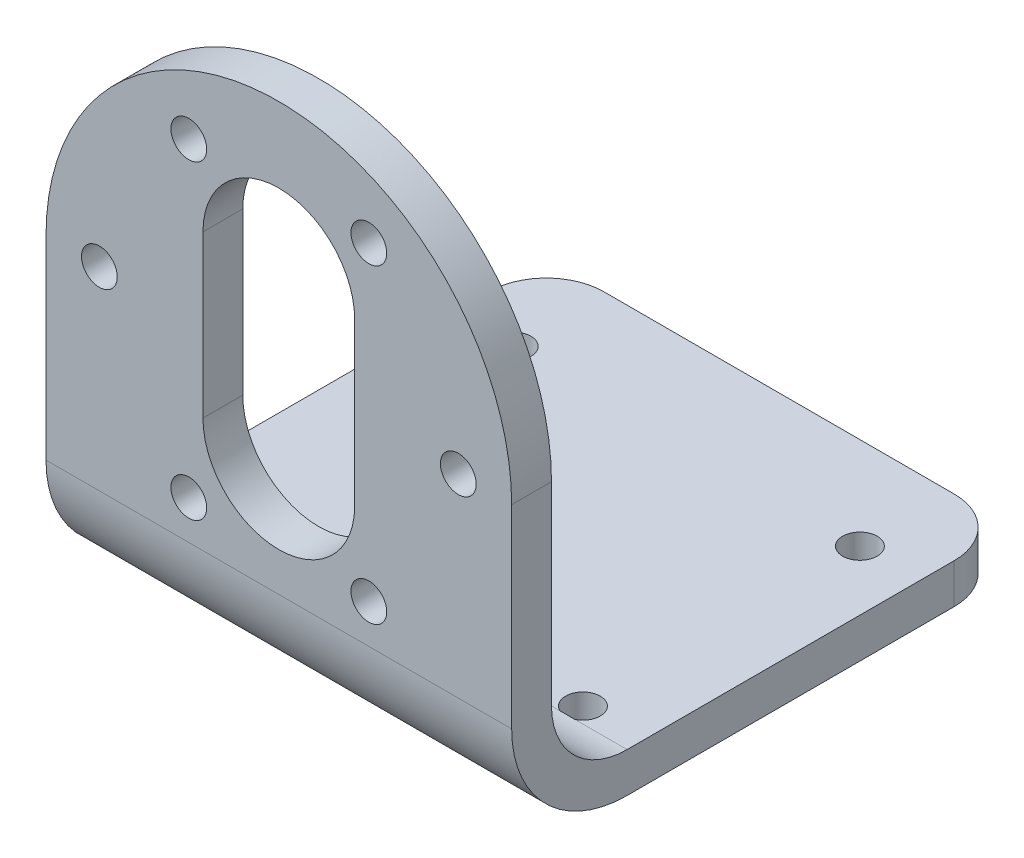
from build123d import *

# Parameters (mm, degrees)
SKETCH1_W           = 40.35
SKETCH1_H           = 43.35
BOSS_EXTRUDE1_DEPTH = 47
CUT_EXTRUDE2_DEPTH  = 102
FILLET1_R           = 10
CUT_EXTRUDE3_DEPTH  = 102
FILLET2_R           = 5
CUT_EXTRUDE5_DEPTH  = 102
SKETCH8_R           = 1.55
CUT_EXTRUDE6_DEPTH  = 102
SKETCH6_R           = 1.5
CUT_EXTRUDE7_DEPTH  = 82.840160626


with BuildPart() as part:
    # Sketch1 → Boss-Extrude1 (new body)
    with BuildSketch(Plane(origin=(0, 0, 0), x_dir=(1, 0, 0), z_dir=(0, 1, 0))):
        with Locations((-26.966212793, -29.108023223)):
            Rectangle(SKETCH1_W, SKETCH1_H)
    extrude(amount=BOSS_EXTRUDE1_DEPTH)

    # Sketch3 → Cut-Extrude2 (cut)
    with BuildSketch(Plane.XY.offset(50.783023223)):
        with BuildLine():
            Line((-47.141212793, 47), (-47.141212793, 26.825))
            ThreePointArc((-47.141212793, 26.825), (-41.232092103, 41.09087931), (-26.966212793, 47))
            Line((-26.966212793, 47), (-47.141212793, 47))
        make_face()
        with BuildLine():
            Line((-6.791212793, 47), (-26.966212793, 47))
            ThreePointArc((-26.966212793, 47), (-12.700333482, 41.09087931), (-6.791212793, 26.825))
            Line((-6.791212793, 26.825), (-6.791212793, 47))
        make_face()
    extrude(amount=-CUT_EXTRUDE2_DEPTH, mode=Mode.SUBTRACT)

    # Fillet1
    fillet1_edges = [part.edges().sort_by_distance(p)[0] for p in [
        (-26.966212793, 0, 50.783023223),
    ]]
    fillet(fillet1_edges, radius=FILLET1_R)

    # Sketch5 → Cut-Extrude3 (cut)
    with BuildSketch(Plane.ZY.offset(47.141212793)):
        with BuildLine():
            Line((-6.665763497, 3.45), (36.595559978, 3.45))
            Line((36.595559978, 3.45), (40.783023223, 3.45))
            ThreePointArc((40.783023223, 3.45), (45.41457264, 5.368450583), (47.333023223, 10))
            Line((47.333023223, 10), (47.333023223, 17.578484004))
            Line((47.333023223, 17.578484004), (47.333023223, 59.778436909))
            Line((47.333023223, 59.778436909), (-6.665763497, 59.778436909))
            Line((-6.665763497, 59.778436909), (-6.665763497, 3.45))
        make_face()
    extrude(amount=-CUT_EXTRUDE3_DEPTH, mode=Mode.SUBTRACT)

    # Fillet2
    fillet2_edges = [part.edges().sort_by_distance(p)[0] for p in [
        (-6.791212793, 1.725, 7.433023223),
        (-47.141212793, 1.725, 7.433023223),
    ]]
    fillet(fillet2_edges, radius=FILLET2_R)

    # Sketch7 → Cut-Extrude5 (cut)
    with BuildSketch(Plane.XY.offset(50.783023223)):
        with BuildLine():
            Line((-33.541212793, 33.925), (-33.541212793, 19.945))
            ThreePointArc((-33.541212793, 19.945), (-26.966212793, 13.37), (-20.391212793, 19.945))
            Line((-20.391212793, 19.945), (-20.391212793, 33.925))
            ThreePointArc((-20.391212793, 33.925), (-26.966212793, 40.5), (-33.541212793, 33.925))
        make_face()
    extrude(amount=-CUT_EXTRUDE5_DEPTH, mode=Mode.SUBTRACT)

    # Sketch8 → Cut-Extrude6 (cut)
    with BuildSketch(Plane.XY.offset(50.783023223)):
        with Locations((-34.766212793, 13.372769702)):
            Circle(SKETCH8_R)
        with Locations((-19.166212793, 13.372769702)):
            Circle(SKETCH8_R)
        with BuildLine():
            ThreePointArc((-12.966212793, 26.825), (-11.416212793, 25.275), (-9.866212793, 26.825))
            Line((-9.866212793, 26.825), (-12.966212793, 26.825))
        make_face()
        with BuildLine():
            Line((-12.966212793, 26.825), (-9.866212793, 26.825))
            ThreePointArc((-9.866212793, 26.825), (-11.416212793, 28.375), (-12.966212793, 26.825))
        make_face()
        with BuildLine():
            ThreePointArc((-44.066212793, 26.825), (-42.516212793, 25.275), (-40.966212793, 26.825))
            Line((-40.966212793, 26.825), (-44.066212793, 26.825))
        make_face()
        with BuildLine():
            Line((-44.066212793, 26.825), (-40.966212793, 26.825))
            ThreePointArc((-40.966212793, 26.825), (-42.516212793, 28.375), (-44.066212793, 26.825))
        make_face()
        with Locations((-34.766212793, 40.277230298)):
            Circle(SKETCH8_R)
        with Locations((-19.166212793, 40.277230298)):
            Circle(SKETCH8_R)
    extrude(amount=-CUT_EXTRUDE6_DEPTH, mode=Mode.SUBTRACT)

    # Sketch6 → Cut-Extrude7 (cut, through all)
    with BuildSketch(Plane(origin=(0, 3.45, 0), x_dir=(1, 0, 0), z_dir=(0, 1, 0))):
        with Locations(Location((-41.966212793, -15.433023223, 0), (0, 0, 270))):
            Circle(SKETCH6_R)
        with Locations(Location((-11.966212793, -15.433023223, 0), (0, 0, 270))):
            Circle(SKETCH6_R)
        with Locations(Location((-41.966212793, -39.433023223, 0), (0, 0, 244.158067237))):
            Circle(SKETCH6_R)
        with Locations(Location((-11.966212793, -39.433023223, 0), (0, 0, 295.841932763))):
            Circle(SKETCH6_R)
    extrude(amount=-CUT_EXTRUDE7_DEPTH, mode=Mode.SUBTRACT)


solid = part.part
